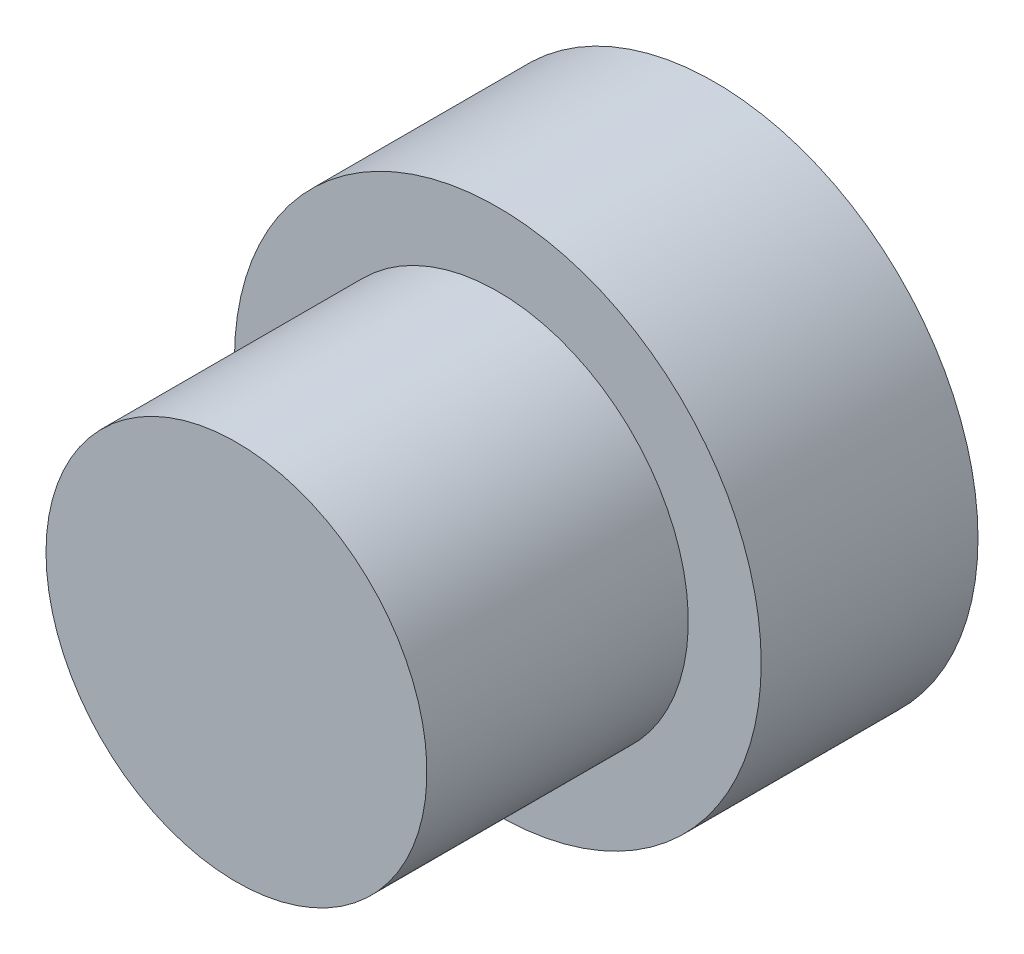
from build123d import *

# Parameters (mm, degrees)
SKETCH2_R           = 13
BOSS_EXTRUDE1_DEPTH = 10.7
SKETCH3_R           = 9.4
BOSS_EXTRUDE2_DEPTH = 12.9


with BuildPart() as part:
    # Sketch2 → Boss-Extrude1 (new body)
    with BuildSketch(Plane.XY):
        with Locations((12.957148987, -1.054651662)):
            Circle(SKETCH2_R)
    extrude(amount=BOSS_EXTRUDE1_DEPTH)

    # Sketch3 → Boss-Extrude2 (add)
    with BuildSketch(Plane.XY.offset(10.7)):
        with Locations(Location((12.957148987, -1.054651662, 0), (0, 0, 180))):
            Circle(SKETCH3_R)
    extrude(amount=BOSS_EXTRUDE2_DEPTH)


solid = part.part
